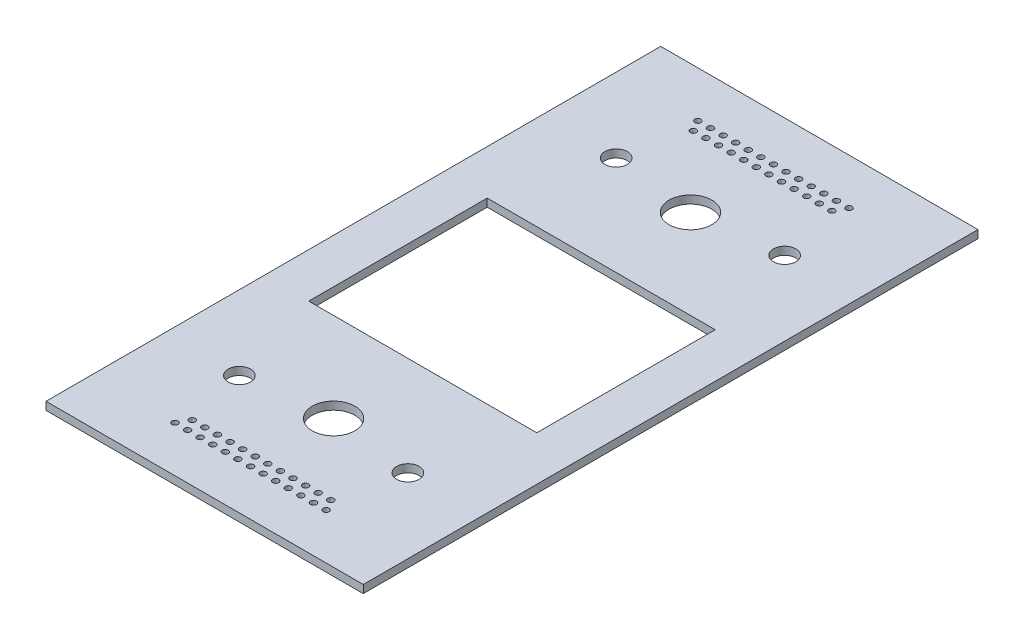
from build123d import *

# Parameters (mm, degrees)
SKETCH2_W           = 32
SKETCH2_H           = 62
SKETCH2_R           = 0.305
SKETCH2_R_2         = 2.15265
SKETCH2_R_3         = 1.1303
SKETCH2_W_2         = 23
SKETCH2_H_2         = 18
BOSS_EXTRUDE1_DEPTH = 0.8


with BuildPart() as part:
    # Sketch2 → Boss-Extrude1 (new body)
    with BuildSketch(Plane(origin=(0, 0, 0), x_dir=(1, 0, 0), z_dir=(0, 1, 0))):
        with Locations((16, -31)):
            Rectangle(SKETCH2_W, SKETCH2_H)
        with Locations(Location((9.02, -5.73, 0), (0, 0, 270))):
            Circle(SKETCH2_R, mode=Mode.SUBTRACT)
        with Locations(Location((16, -13, 0), (0, 0, 270))):
            Circle(SKETCH2_R_2, mode=Mode.SUBTRACT)
        with Locations(Location((24.5, -12, 0), (0, 0, 270))):
            Circle(SKETCH2_R_3, mode=Mode.SUBTRACT)
        with Locations(Location((7.5, -12, 0), (0, 0, 270))):
            Circle(SKETCH2_R_3, mode=Mode.SUBTRACT)
        with Locations(Location((8.38, -4.63, 0), (0, 0, 270))):
            Circle(SKETCH2_R, mode=Mode.SUBTRACT)
        with Locations(Location((7.5, -50, 0), (0, 0, 270))):
            Circle(SKETCH2_R_3, mode=Mode.SUBTRACT)
        with Locations(Location((24.5, -50, 0), (0, 0, 270))):
            Circle(SKETCH2_R_3, mode=Mode.SUBTRACT)
        with Locations(Location((16, -49, 0), (0, 0, 270))):
            Circle(SKETCH2_R_2, mode=Mode.SUBTRACT)
        with Locations(Location((9.65, -4.63, 0), (0, 0, 270))):
            Circle(SKETCH2_R, mode=Mode.SUBTRACT)
        with Locations(Location((10.92, -4.63, 0), (0, 0, 270))):
            Circle(SKETCH2_R, mode=Mode.SUBTRACT)
        with Locations(Location((12.19, -4.63, 0), (0, 0, 270))):
            Circle(SKETCH2_R, mode=Mode.SUBTRACT)
        with Locations(Location((13.46, -4.63, 0), (0, 0, 270))):
            Circle(SKETCH2_R, mode=Mode.SUBTRACT)
        with Locations(Location((14.73, -4.63, 0), (0, 0, 270))):
            Circle(SKETCH2_R, mode=Mode.SUBTRACT)
        with Locations(Location((16, -4.63, 0), (0, 0, 270))):
            Circle(SKETCH2_R, mode=Mode.SUBTRACT)
        with Locations(Location((17.27, -4.63, 0), (0, 0, 270))):
            Circle(SKETCH2_R, mode=Mode.SUBTRACT)
        with Locations(Location((18.54, -4.63, 0), (0, 0, 270))):
            Circle(SKETCH2_R, mode=Mode.SUBTRACT)
        with Locations(Location((19.81, -4.63, 0), (0, 0, 270))):
            Circle(SKETCH2_R, mode=Mode.SUBTRACT)
        with Locations(Location((21.08, -4.63, 0), (0, 0, 270))):
            Circle(SKETCH2_R, mode=Mode.SUBTRACT)
        with Locations(Location((22.35, -4.63, 0), (0, 0, 270))):
            Circle(SKETCH2_R, mode=Mode.SUBTRACT)
        with Locations(Location((23.62, -4.63, 0), (0, 0, 270))):
            Circle(SKETCH2_R, mode=Mode.SUBTRACT)
        with Locations(Location((10.29, -5.73, 0), (0, 0, 270))):
            Circle(SKETCH2_R, mode=Mode.SUBTRACT)
        with Locations(Location((11.56, -5.73, 0), (0, 0, 270))):
            Circle(SKETCH2_R, mode=Mode.SUBTRACT)
        with Locations(Location((12.83, -5.73, 0), (0, 0, 270))):
            Circle(SKETCH2_R, mode=Mode.SUBTRACT)
        with Locations(Location((14.1, -5.73, 0), (0, 0, 270))):
            Circle(SKETCH2_R, mode=Mode.SUBTRACT)
        with Locations(Location((15.37, -5.73, 0), (0, 0, 270))):
            Circle(SKETCH2_R, mode=Mode.SUBTRACT)
        with Locations(Location((16.64, -5.73, 0), (0, 0, 270))):
            Circle(SKETCH2_R, mode=Mode.SUBTRACT)
        with Locations(Location((17.91, -5.73, 0), (0, 0, 270))):
            Circle(SKETCH2_R, mode=Mode.SUBTRACT)
        with Locations(Location((19.18, -5.73, 0), (0, 0, 270))):
            Circle(SKETCH2_R, mode=Mode.SUBTRACT)
        with Locations(Location((20.45, -5.73, 0), (0, 0, 270))):
            Circle(SKETCH2_R, mode=Mode.SUBTRACT)
        with Locations(Location((21.72, -5.73, 0), (0, 0, 270))):
            Circle(SKETCH2_R, mode=Mode.SUBTRACT)
        with Locations(Location((22.99, -5.73, 0), (0, 0, 270))):
            Circle(SKETCH2_R, mode=Mode.SUBTRACT)
        with Locations(Location((22.99, -56.27, 0), (0, 0, 270))):
            Circle(SKETCH2_R, mode=Mode.SUBTRACT)
        with Locations(Location((21.72, -56.27, 0), (0, 0, 270))):
            Circle(SKETCH2_R, mode=Mode.SUBTRACT)
        with Locations(Location((20.45, -56.27, 0), (0, 0, 270))):
            Circle(SKETCH2_R, mode=Mode.SUBTRACT)
        with Locations(Location((19.18, -56.27, 0), (0, 0, 270))):
            Circle(SKETCH2_R, mode=Mode.SUBTRACT)
        with Locations(Location((17.91, -56.27, 0), (0, 0, 270))):
            Circle(SKETCH2_R, mode=Mode.SUBTRACT)
        with Locations(Location((16.64, -56.27, 0), (0, 0, 270))):
            Circle(SKETCH2_R, mode=Mode.SUBTRACT)
        with Locations(Location((15.37, -56.27, 0), (0, 0, 270))):
            Circle(SKETCH2_R, mode=Mode.SUBTRACT)
        with Locations(Location((14.1, -56.27, 0), (0, 0, 270))):
            Circle(SKETCH2_R, mode=Mode.SUBTRACT)
        with Locations(Location((12.83, -56.27, 0), (0, 0, 270))):
            Circle(SKETCH2_R, mode=Mode.SUBTRACT)
        with Locations(Location((11.56, -56.27, 0), (0, 0, 270))):
            Circle(SKETCH2_R, mode=Mode.SUBTRACT)
        with Locations(Location((10.29, -56.27, 0), (0, 0, 270))):
            Circle(SKETCH2_R, mode=Mode.SUBTRACT)
        with Locations(Location((23.62, -57.37, 0), (0, 0, 270))):
            Circle(SKETCH2_R, mode=Mode.SUBTRACT)
        with Locations(Location((22.35, -57.37, 0), (0, 0, 270))):
            Circle(SKETCH2_R, mode=Mode.SUBTRACT)
        with Locations(Location((21.08, -57.37, 0), (0, 0, 270))):
            Circle(SKETCH2_R, mode=Mode.SUBTRACT)
        with Locations(Location((19.81, -57.37, 0), (0, 0, 270))):
            Circle(SKETCH2_R, mode=Mode.SUBTRACT)
        with Locations(Location((18.54, -57.37, 0), (0, 0, 270))):
            Circle(SKETCH2_R, mode=Mode.SUBTRACT)
        with Locations(Location((17.27, -57.37, 0), (0, 0, 270))):
            Circle(SKETCH2_R, mode=Mode.SUBTRACT)
        with Locations(Location((16, -57.37, 0), (0, 0, 270))):
            Circle(SKETCH2_R, mode=Mode.SUBTRACT)
        with Locations(Location((14.73, -57.37, 0), (0, 0, 270))):
            Circle(SKETCH2_R, mode=Mode.SUBTRACT)
        with Locations(Location((13.46, -57.37, 0), (0, 0, 270))):
            Circle(SKETCH2_R, mode=Mode.SUBTRACT)
        with Locations(Location((12.19, -57.37, 0), (0, 0, 270))):
            Circle(SKETCH2_R, mode=Mode.SUBTRACT)
        with Locations(Location((10.92, -57.37, 0), (0, 0, 270))):
            Circle(SKETCH2_R, mode=Mode.SUBTRACT)
        with Locations(Location((9.65, -57.37, 0), (0, 0, 270))):
            Circle(SKETCH2_R, mode=Mode.SUBTRACT)
        with Locations(Location((8.38, -57.37, 0), (0, 0, 270))):
            Circle(SKETCH2_R, mode=Mode.SUBTRACT)
        with Locations(Location((9.02, -56.27, 0), (0, 0, 270))):
            Circle(SKETCH2_R, mode=Mode.SUBTRACT)
        with Locations((16, -31)):
            Rectangle(SKETCH2_W_2, SKETCH2_H_2, mode=Mode.SUBTRACT)
    extrude(amount=BOSS_EXTRUDE1_DEPTH)


solid = part.part
